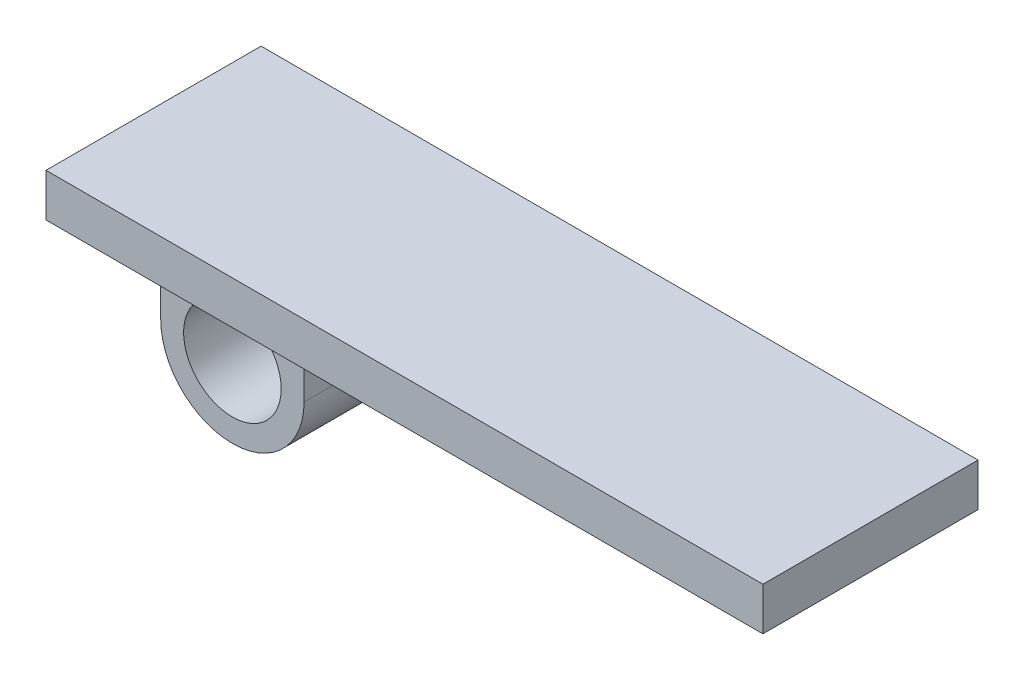
from build123d import *

# Parameters (mm, degrees)
SKETCH_1_R      = 3.4
EXTRUDE_1_DEPTH = 7
SKETCH_2_W      = 50
SKETCH_2_H      = 15
EXTRUDE_2_DEPTH = 3


with BuildPart() as part:
    # 草图1 → 凸台-拉伸1 (new body)
    with BuildSketch(Plane.XY):
        with BuildLine():
            Line((-5, 0), (-5, 10))
            Line((-5, 10), (5, 10))
            Line((5, 10), (5, 0))
            ThreePointArc((5, 0), (0, -5), (-5, 0))
        make_face()
        Circle(SKETCH_1_R, mode=Mode.SUBTRACT)
    extrude(amount=EXTRUDE_1_DEPTH)

    # 草图2 → 凸台-拉伸2 (add)
    with BuildSketch(Plane(origin=(0, 10, 0), x_dir=(1, 0, 0), z_dir=(0, 1, 0))):
        with Locations((20, -7.5)):
            Rectangle(SKETCH_2_W, SKETCH_2_H)
    extrude(amount=EXTRUDE_2_DEPTH)


solid = part.part
